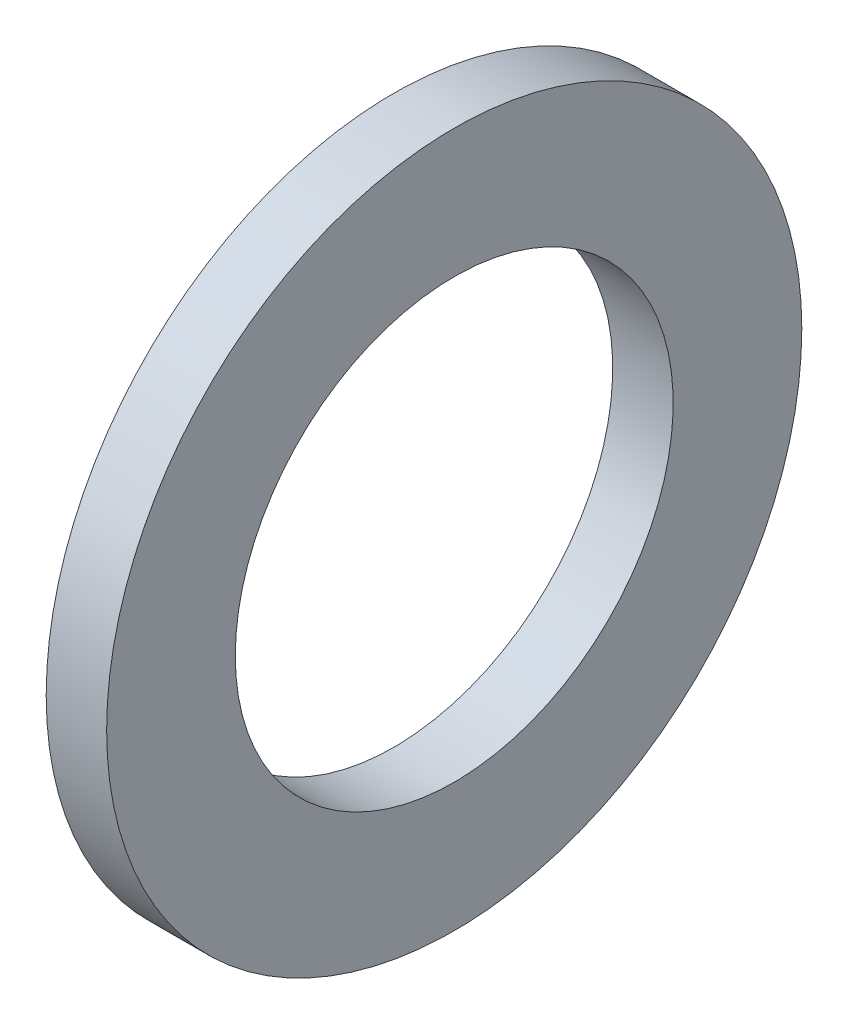
from build123d import *

# Parameters (mm, degrees)
SKETCH1_W = 0.508
SKETCH1_H = 1.081


with BuildPart() as part:
    # Sketch1 → Base-Revolve (revolve)
    with BuildSketch(Plane.XY, mode=Mode.PRIVATE) as base_revolve_sk:
        with Locations((-0.254, 2.3805)):
            Rectangle(SKETCH1_W, SKETCH1_H)
    revolve(base_revolve_sk.sketch.rotate(Axis((-34.925, 0, 0), (1, 0, 0)), 90), axis=Axis((-34.925, 0, 0), (1, 0, 0)))


solid = part.part
